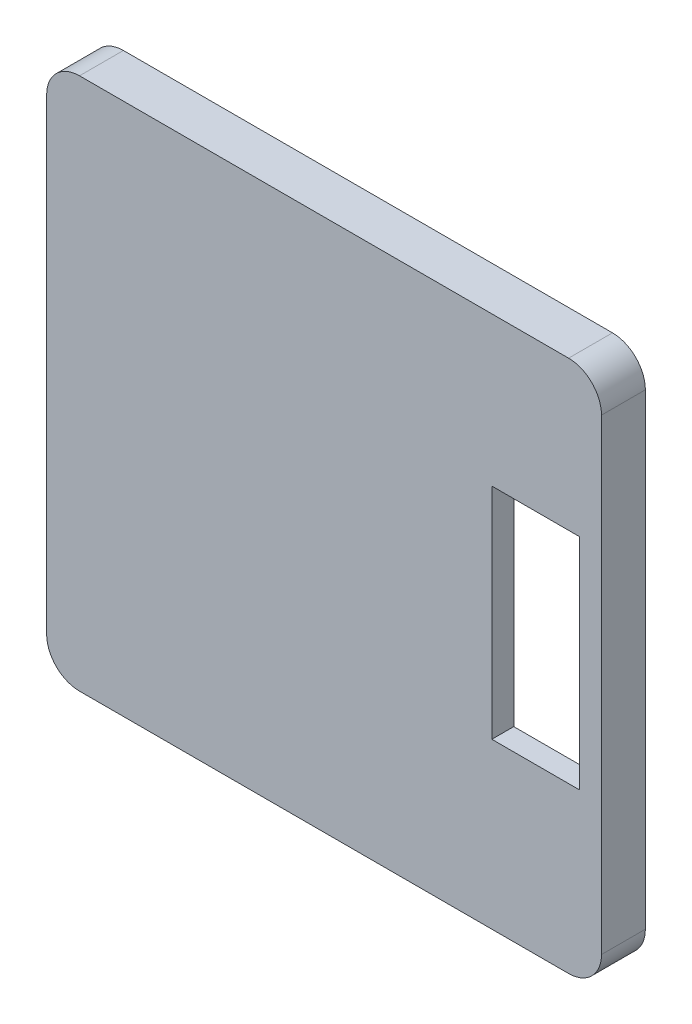
from build123d import *

# Parameters (mm, degrees)
SKETCH1_W           = 45
SKETCH1_H           = 40
BOSS_EXTRUDE1_DEPTH = 2
SKETCH2_W           = 2
SKETCH2_H           = 42.8
BOSS_EXTRUDE2_DEPTH = 45
FILLET1_R           = 1
SKETCH3_W           = 2
SKETCH3_H           = 13
CUT_EXTRUDE1_DEPTH  = 11
SKETCH4_W           = 8
SKETCH4_H           = 20
CUT_EXTRUDE2_DEPTH  = 11


with BuildPart() as part:
    # Sketch1 → Boss-Extrude1 (new, symmetric)
    with BuildSketch(Plane.XY):
        with BuildLine():
            Line((-22.555173768, -23.917239348), (22.044826232, -23.917239348))
            ThreePointArc((22.044826232, -23.917239348), (24.166146575, -23.038559691), (25.044826232, -20.917239348))
            Line((25.044826232, -20.917239348), (25.044826232, 21.682760652))
            ThreePointArc((25.044826232, 21.682760652), (24.166146575, 23.804080996), (22.044826232, 24.682760652))
            Line((22.044826232, 24.682760652), (-22.555173768, 24.682760652))
            ThreePointArc((-22.555173768, 24.682760652), (-24.676494112, 23.804080996), (-25.555173768, 21.682760652))
            Line((-25.555173768, 21.682760652), (-25.555173768, -20.917239348))
            ThreePointArc((-25.555173768, -20.917239348), (-24.676494112, -23.038559691), (-22.555173768, -23.917239348))
        make_face()
        with Locations((-0.255173768, 1.882760652)):
            Rectangle(SKETCH1_W, SKETCH1_H, mode=Mode.SUBTRACT)
    extrude(amount=BOSS_EXTRUDE1_DEPTH, both=True)

    # Sketch2 → Boss-Extrude2 (add)
    with BuildSketch(Plane(origin=(-22.755173768, 0, 0), x_dir=(0, 0, -1), z_dir=(1, 0, 0))):
        with Locations((-1, 0.482760652)):
            Rectangle(SKETCH2_W, SKETCH2_H)
    extrude(amount=BOSS_EXTRUDE2_DEPTH)

    # Fillet1
    fillet1_edges = [part.edges().sort_by_distance(p)[0] for p in [
        (22.244826232, 21.882760652, -1),
        (-22.755173768, 21.882760652, -1),
        (22.244826232, -18.117239348, -1),
        (-22.755173768, -18.117239348, -1),
        (-0.255173768, -18.117239348, 0),
        (-0.255173768, 21.882760652, 0),
        (-22.755173768, 1.882760652, 0),
        (22.244826232, 1.882760652, 0),
    ]]
    fillet(fillet1_edges, radius=FILLET1_R)

    # Sketch3 → Cut-Extrude1 (cut)
    with BuildSketch(Plane.ZY.offset(25.555173768)):
        with Locations((-1, -0.417239348)):
            Rectangle(SKETCH3_W, SKETCH3_H)
    extrude(amount=-CUT_EXTRUDE1_DEPTH, mode=Mode.SUBTRACT)

    # Sketch4 → Cut-Extrude2 (cut)
    with BuildSketch(Plane.XY.offset(2)):
        with Locations((19.044826232, 1.082760652)):
            Rectangle(SKETCH4_W, SKETCH4_H)
    extrude(amount=-CUT_EXTRUDE2_DEPTH, mode=Mode.SUBTRACT)


solid = part.part
